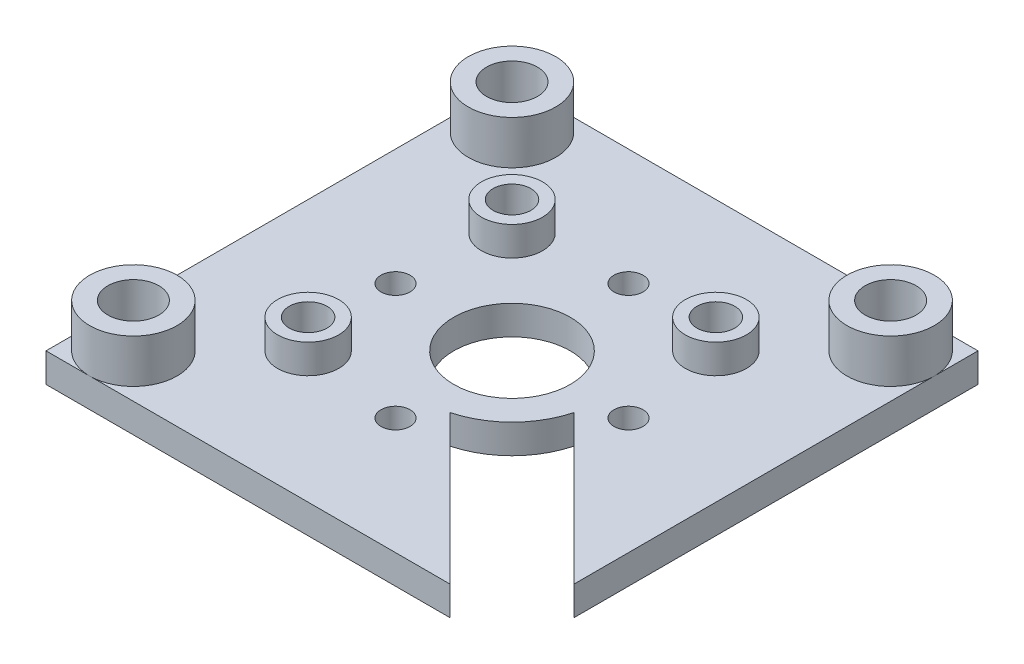
from build123d import *

# Parameters (mm, degrees)
SKETCH_1_W          = 32
SKETCH_1_H          = 32
SKETCH_1_R          = 1
SKETCH_1_R_2        = 4
SKETCH_1_R_3        = 1.75
EXTRUDE_1_DEPTH     = 2
SKETCH_2_R          = 2.1
SKETCH_2_R_2        = 1.3
EXTRUDE_3_DEPTH     = 2
CUT_EXTRUDE_START   = -2
SKETCH_2_6_R        = 1.3
SKETCH_2_6_R_2      = 1.75
SKETCH_2_6_R_3      = 2.1
CUT_EXTRUDE_2_DEPTH = 2
SKETCH_3_R          = 3
SKETCH_3_R_2        = 1.75
EXTRUDE_5_DEPTH     = 5


with BuildPart() as part:
    # 草图1 → 凸台-拉伸1 (new body)
    with BuildSketch(Plane(origin=(0, 0, 0), x_dir=(1, 0, 0), z_dir=(0, 1, 0))):
        Rectangle(SKETCH_1_W, SKETCH_1_H)
        with Locations(Location((8, 0, 0), (0, 0, 270))):
            Circle(SKETCH_1_R, mode=Mode.SUBTRACT)
        with Locations(Location((0, -8, 0), (0, 0, 270))):
            Circle(SKETCH_1_R, mode=Mode.SUBTRACT)
        with Locations(Location((-8, 0, 0), (0, 0, 270))):
            Circle(SKETCH_1_R, mode=Mode.SUBTRACT)
        with Locations(Location((0, 8, 0), (0, 0, 270))):
            Circle(SKETCH_1_R, mode=Mode.SUBTRACT)
        with Locations(Location((0, 0, 0), (0, 0, 270))):
            Circle(SKETCH_1_R_2, mode=Mode.SUBTRACT)
        with Locations(Location((13, 13, 0), (0, 0, 270))):
            Circle(SKETCH_1_R_3, mode=Mode.SUBTRACT)
        with Locations(Location((-13, 13, 0), (0, 0, 270))):
            Circle(SKETCH_1_R_3, mode=Mode.SUBTRACT)
        with Locations(Location((13, -13, 0), (0, 0, 270))):
            Circle(SKETCH_1_R_3, mode=Mode.SUBTRACT)
        with Locations(Location((-13, -13, 0), (0, 0, 270))):
            Circle(SKETCH_1_R_3, mode=Mode.SUBTRACT)
    extrude(amount=EXTRUDE_1_DEPTH)

    # 草图2 → 凸台-拉伸3 (add)
    # profile 1 of 3: a face of its own
    with BuildSketch(Plane(origin=(0, 2, 0), x_dir=(1, 0, 0), z_dir=(0, 1, 0))):
        with Locations(Location((-7, -7, 0), (0, 0, 270))):
            Circle(SKETCH_2_R)
        with Locations(Location((-7, -7, 0), (0, 0, 270))):
            Circle(SKETCH_2_R_2, mode=Mode.SUBTRACT)
    # profile 2 of 3: a face of its own
    with BuildSketch(Plane(origin=(0, 2, 0), x_dir=(1, 0, 0), z_dir=(0, 1, 0))):
        with Locations(Location((-7, 7, 0), (0, 0, 270))):
            Circle(SKETCH_2_R)
        with Locations(Location((-7, 7, 0), (0, 0, 270))):
            Circle(SKETCH_2_R_2, mode=Mode.SUBTRACT)
    # profile 3 of 3: a face of its own
    with BuildSketch(Plane(origin=(0, 2, 0), x_dir=(1, 0, 0), z_dir=(0, 1, 0))):
        with Locations(Location((7, 7, 0), (0, 0, 270))):
            Circle(SKETCH_2_R)
        with Locations(Location((7, 7, 0), (0, 0, 270))):
            Circle(SKETCH_2_R_2, mode=Mode.SUBTRACT)
    extrude(amount=EXTRUDE_3_DEPTH)

    # 草图2<6> → 切除-拉伸2 (cut)
    # profile 1 of 6: a face of its own
    with BuildSketch(Plane(origin=(0, 2, 0), x_dir=(1, 0, 0), z_dir=(0, 1, 0)).offset(CUT_EXTRUDE_START)):
        with Locations(Location((-7, 7, 0), (0, 0, 270))):
            Circle(SKETCH_2_6_R)
    # profile 2 of 6: a face of its own
    with BuildSketch(Plane(origin=(0, 2, 0), x_dir=(1, 0, 0), z_dir=(0, 1, 0)).offset(CUT_EXTRUDE_START)):
        with Locations(Location((-7, -7, 0), (0, 0, 270))):
            Circle(SKETCH_2_6_R)
    # profile 3 of 6: a face of its own
    with BuildSketch(Plane(origin=(0, 2, 0), x_dir=(1, 0, 0), z_dir=(0, 1, 0)).offset(CUT_EXTRUDE_START)):
        with Locations(Location((7, 7, 0), (0, 0, 270))):
            Circle(SKETCH_2_6_R)
    # profile 4 of 6: a face of its own
    with BuildSketch(Plane(origin=(0, 2, 0), x_dir=(1, 0, 0), z_dir=(0, 1, 0)).offset(CUT_EXTRUDE_START)):
        with BuildLine():
            Line((16, -11.757359313), (5.795554958, -1.552914271))
            ThreePointArc((5.795554958, -1.552914271), (4.242640687, -4.242640687), (1.552914271, -5.795554958))
            Line((1.552914271, -5.795554958), (11.757359313, -16))
            Line((11.757359313, -16), (16, -16))
            Line((16, -16), (16, -11.757359313))
        make_face()
        with Locations((13, -13)):
            Circle(SKETCH_2_6_R_2, mode=Mode.SUBTRACT)
        with Locations((7, -7)):
            Circle(SKETCH_2_6_R_3, mode=Mode.SUBTRACT)
    # profile 5 of 6: a face of its own
    with BuildSketch(Plane(origin=(0, 2, 0), x_dir=(1, 0, 0), z_dir=(0, 1, 0)).offset(CUT_EXTRUDE_START)):
        with Locations((7, -7)):
            Circle(SKETCH_2_6_R_3)
        with Locations((7, -7)):
            Circle(SKETCH_2_6_R, mode=Mode.SUBTRACT)
    # profile 6 of 6: a face of its own
    with BuildSketch(Plane(origin=(0, 2, 0), x_dir=(1, 0, 0), z_dir=(0, 1, 0)).offset(CUT_EXTRUDE_START)):
        with Locations((7, -7)):
            Circle(SKETCH_2_6_R)
    extrude(amount=CUT_EXTRUDE_2_DEPTH, mode=Mode.SUBTRACT)

    # 草图3 → 凸台-拉伸5 (add)
    # profile 1 of 3: a face of its own
    with BuildSketch(Plane.XZ):
        with Locations(Location((-13, 13, 0), (0, 0, 270))):
            Circle(SKETCH_3_R)
        with Locations(Location((-13, 13, 0), (0, 0, 270))):
            Circle(SKETCH_3_R_2, mode=Mode.SUBTRACT)
    # profile 2 of 3: a face of its own
    with BuildSketch(Plane.XZ):
        with Locations(Location((-13, -13, 0), (0, 0, 270))):
            Circle(SKETCH_3_R)
        with Locations(Location((-13, -13, 0), (0, 0, 90))):
            Circle(SKETCH_3_R_2, mode=Mode.SUBTRACT)
    # profile 3 of 3: a face of its own
    with BuildSketch(Plane.XZ):
        with Locations(Location((13, -13, 0), (0, 0, 270))):
            Circle(SKETCH_3_R)
        with Locations(Location((13, -13, 0), (0, 0, 270))):
            Circle(SKETCH_3_R_2, mode=Mode.SUBTRACT)
    extrude(amount=-EXTRUDE_5_DEPTH)


solid = part.part
